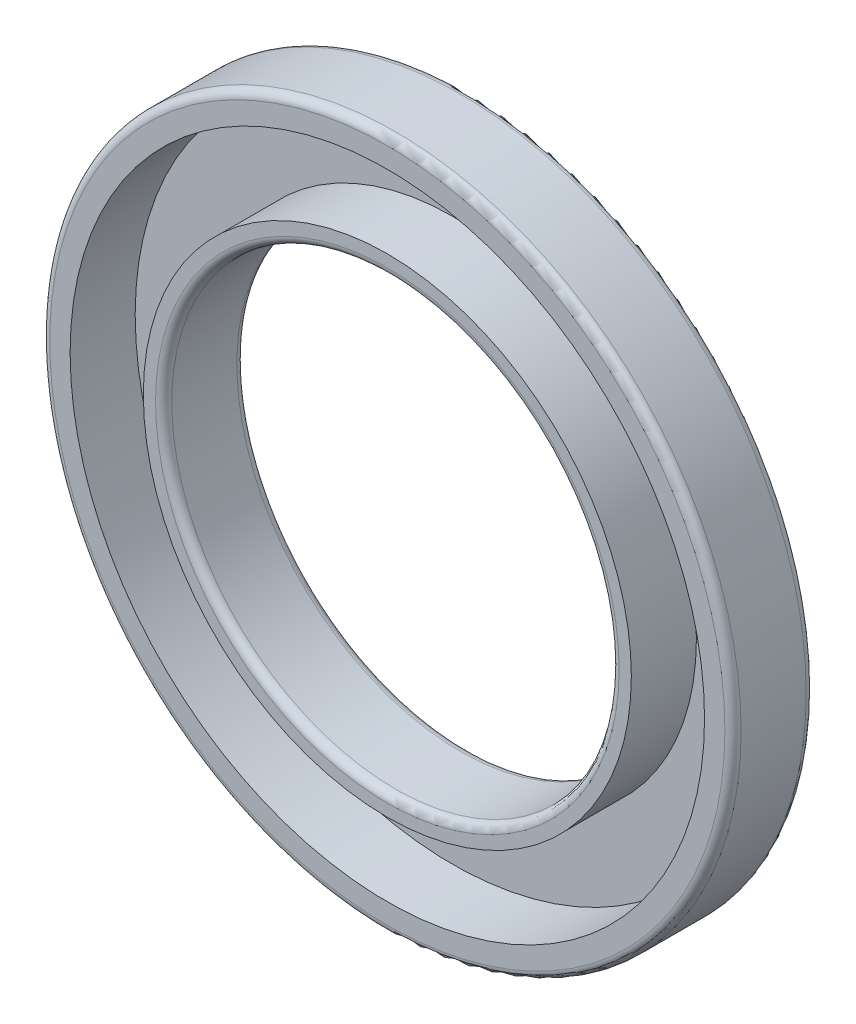
from build123d import *

# Parameters (mm, degrees)
SKETCH1_R           = 42.5
SKETCH1_R_2         = 27.5
BOSS_EXTRUDE1_DEPTH = 10
SKETCH2_R           = 39
SKETCH2_R_2         = 30
CUT_EXTRUDE1_DEPTH  = 8
FILLET1_R           = 1


with BuildPart() as part:
    # Sketch1 → Boss-Extrude1 (new body)
    with BuildSketch(Plane.XY):
        Circle(SKETCH1_R)
        Circle(SKETCH1_R_2, mode=Mode.SUBTRACT)
    extrude(amount=BOSS_EXTRUDE1_DEPTH)

    # Sketch2 → Cut-Extrude1 (cut)
    with BuildSketch(Plane.XY.offset(10)):
        Circle(SKETCH2_R)
        Circle(SKETCH2_R_2, mode=Mode.SUBTRACT)
    extrude(amount=-CUT_EXTRUDE1_DEPTH, mode=Mode.SUBTRACT)

    # Fillet1
    fillet1_edges = [part.edges().sort_by_distance(p)[0] for p in [
        (-42.5, 0, 0),
        (-42.5, 0, 10),
        (-27.5, 0, 0),
        (-27.5, 0, 10),
    ]]
    fillet(fillet1_edges, radius=FILLET1_R)


solid = part.part
